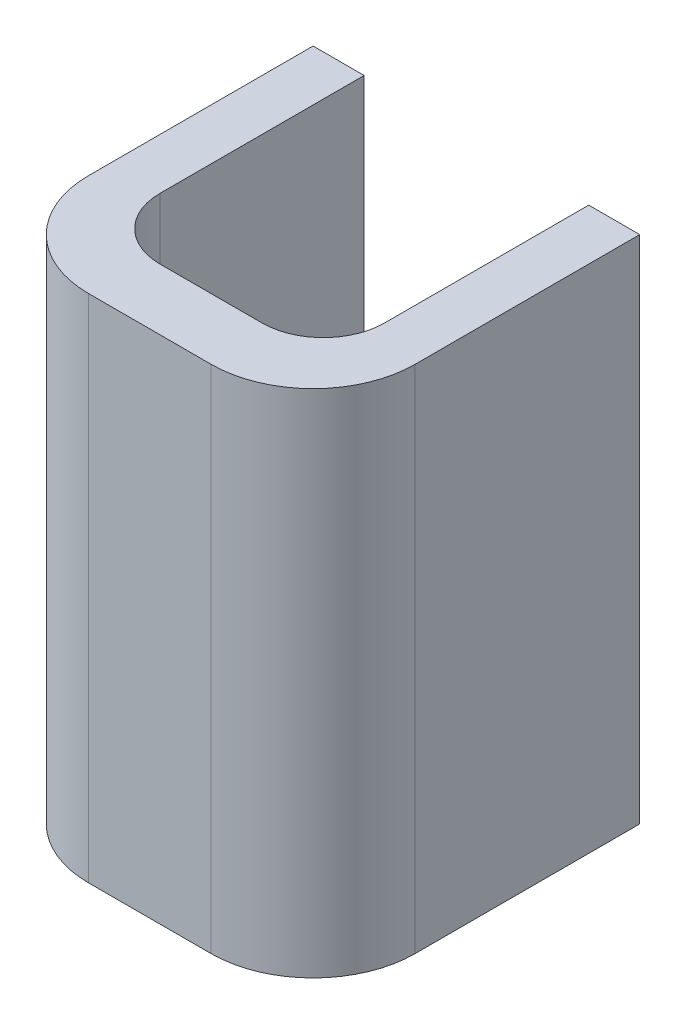
from build123d import *

# Parameters (mm, degrees)
SKETCH_1_W      = 2.5
SKETCH_1_H      = 13
SKETCH_1_W_2    = 16
SKETCH_1_H_2    = 3
EXTRUDE_1_DEPTH = 25
FILLET_1_R      = 3
FILLET_2_R      = 5


with BuildPart() as part:
    # 草图1 → 凸台-拉伸1 (new body)
    with BuildSketch(Plane(origin=(0, 0, 0), x_dir=(1, 0, 0), z_dir=(0, 1, 0))):
        with Locations((6.75, 8)):
            Rectangle(SKETCH_1_W, SKETCH_1_H)
        Rectangle(SKETCH_1_W_2, SKETCH_1_H_2)
        with Locations((-6.75, 8)):
            Rectangle(SKETCH_1_W, SKETCH_1_H)
    extrude(amount=EXTRUDE_1_DEPTH)

    # 圆角1
    fillet_1_edges = [part.edges().sort_by_distance(p)[0] for p in [
        (-5.5, 12.5, -1.5),
        (5.5, 12.5, -1.5),
    ]]
    fillet(fillet_1_edges, radius=FILLET_1_R)

    # 圆角2
    fillet_2_edges = [part.edges().sort_by_distance(p)[0] for p in [
        (8, 12.5, 1.5),
        (-8, 12.5, 1.5),
    ]]
    fillet(fillet_2_edges, radius=FILLET_2_R)


solid = part.part
